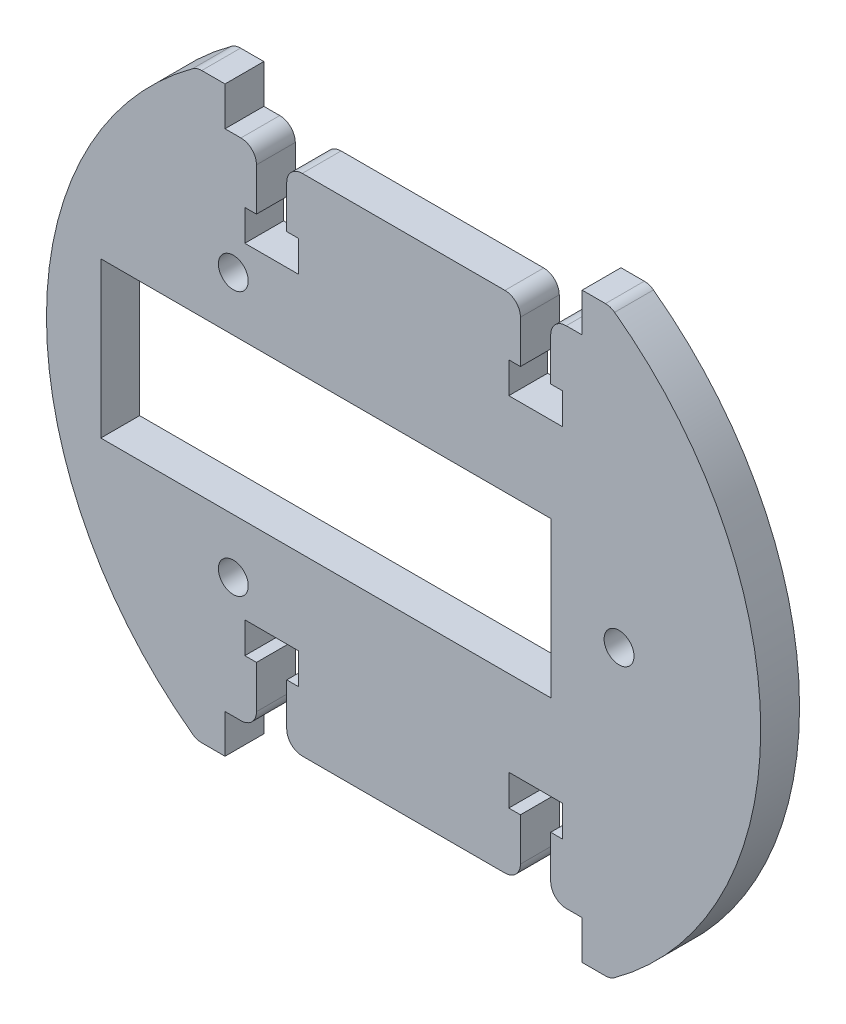
from build123d import *

# Parameters (mm, degrees)
ESQUISSE1_R        = 1.925
ESQUISSE1_W        = 58
ESQUISSE1_H        = 20
BOSS_EXTRU_1_DEPTH = 5


with BuildPart() as part:
    # Esquisse1 → Boss.-Extru.1 (new body)
    with BuildSketch(Plane.XY):
        with BuildLine():
            Line((13.05, 32.5), (-13.05, 32.5))
            ThreePointArc((-13.05, 32.5), (-14.464213562, 31.914213562), (-15.05, 30.5))
            Line((-15.05, 30.5), (-15.05, 25))
            Line((-15.05, 25), (-13.55, 25))
            Line((-13.55, 25), (-13.55, 21))
            Line((-13.55, 21), (-20.45, 21))
            Line((-20.45, 21), (-20.45, 25))
            Line((-20.45, 25), (-18.95, 25))
            Line((-18.95, 25), (-18.95, 30.5))
            ThreePointArc((-18.95, 30.5), (-19.535786438, 31.914213562), (-20.95, 32.5))
            Line((-20.95, 32.5), (-23, 32.5))
            Line((-23, 32.5), (-23, 37.5))
            Line((-23, 37.5), (-25.999999067, 37.497633905))
            ThreePointArc((-25.999999067, 37.497633905), (-26.620839292, 37.398317642), (-27.180168114, 37.111163374))
            ThreePointArc((-27.180168114, 37.111163374), (-45.999999844, 0), (-27.180168114, -37.111163374))
            ThreePointArc((-27.180168114, -37.111163374), (-26.620839292, -37.398317642), (-25.999999067, -37.497633905))
            Line((-25.999999067, -37.497633905), (-23, -37.5))
            Line((-23, -37.5), (-23, -32.5))
            Line((-23, -32.5), (-20.95, -32.5))
            ThreePointArc((-20.95, -32.5), (-19.535786438, -31.914213562), (-18.95, -30.5))
            Line((-18.95, -30.5), (-18.95, -25))
            Line((-18.95, -25), (-20.45, -25))
            Line((-20.45, -25), (-20.45, -21))
            Line((-20.45, -21), (-13.55, -21))
            Line((-13.55, -21), (-13.55, -25))
            Line((-13.55, -25), (-15.05, -25))
            Line((-15.05, -25), (-15.05, -30.5))
            ThreePointArc((-15.05, -30.5), (-14.464213562, -31.914213562), (-13.05, -32.5))
            Line((-13.05, -32.5), (13.05, -32.5))
            ThreePointArc((13.05, -32.5), (14.464213562, -31.914213562), (15.05, -30.5))
            Line((15.05, -30.5), (15.05, -25))
            Line((15.05, -25), (13.55, -25))
            Line((13.55, -25), (13.55, -21))
            Line((13.55, -21), (20.45, -21))
            Line((20.45, -21), (20.45, -25))
            Line((20.45, -25), (18.95, -25))
            Line((18.95, -25), (18.95, -30.5))
            ThreePointArc((18.95, -30.5), (19.535786438, -31.914213562), (20.95, -32.5))
            Line((20.95, -32.5), (23, -32.5))
            Line((23, -32.5), (23, -37.5))
            Line((23, -37.5), (25.999999067, -37.497633905))
            ThreePointArc((25.999999067, -37.497633905), (26.620839292, -37.398317642), (27.180168114, -37.111163374))
            ThreePointArc((27.180168114, -37.111163374), (45.999999844, 0), (27.180168114, 37.111163374))
            ThreePointArc((27.180168114, 37.111163374), (26.620839292, 37.398317642), (25.999999067, 37.497633905))
            Line((25.999999067, 37.497633905), (23, 37.5))
            Line((23, 37.5), (23, 32.5))
            Line((23, 32.5), (20.95, 32.5))
            ThreePointArc((20.95, 32.5), (19.535786438, 31.914213562), (18.95, 30.5))
            Line((18.95, 30.5), (18.95, 25))
            Line((18.95, 25), (20.45, 25))
            Line((20.45, 25), (20.45, 21))
            Line((20.45, 21), (13.55, 21))
            Line((13.55, 21), (13.55, 25))
            Line((13.55, 25), (15.05, 25))
            Line((15.05, 25), (15.05, 30.5))
            ThreePointArc((15.05, 30.5), (14.464213562, 31.914213562), (13.05, 32.5))
        make_face()
        with Locations((27.75, 0)):
            Circle(ESQUISSE1_R, mode=Mode.SUBTRACT)
        with Locations((-21.933137835, -17)):
            Circle(ESQUISSE1_R, mode=Mode.SUBTRACT)
        with Locations((-21.933137835, 17)):
            Circle(ESQUISSE1_R, mode=Mode.SUBTRACT)
        with Locations((-10, 0)):
            Rectangle(ESQUISSE1_W, ESQUISSE1_H, mode=Mode.SUBTRACT)
    extrude(amount=BOSS_EXTRU_1_DEPTH)


solid = part.part
